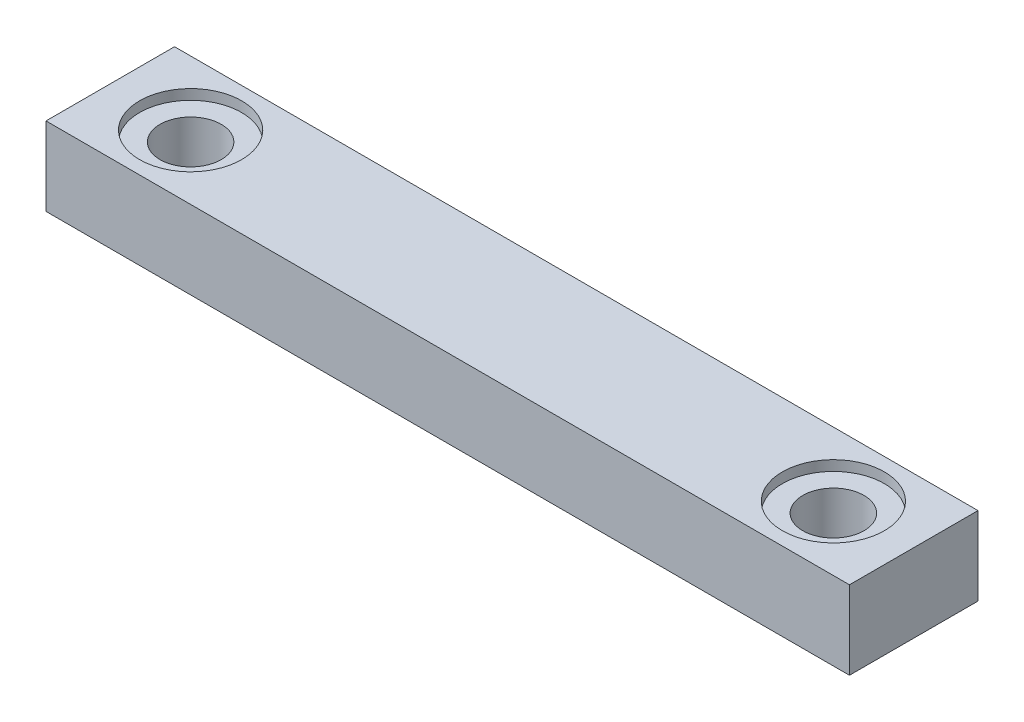
from build123d import *

# Parameters (mm, degrees)
SKETCH1_W           = 250
SKETCH1_H           = 40
SKETCH1_R           = 9.525
BOSS_EXTRUDE1_DEPTH = 24.392721671
SKETCH3_R           = 15.875
CUT_EXTRUDE1_DEPTH  = 3.175


with BuildPart() as part:
    # Sketch1 → Boss-Extrude1 (new body)
    with BuildSketch(Plane(origin=(0, 0, 0), x_dir=(1, 0, 0), z_dir=(0, 1, 0))):
        Rectangle(SKETCH1_W, SKETCH1_H)
        with Locations(Location((-100, 0, 0), (0, 0, 270))):
            Circle(SKETCH1_R, mode=Mode.SUBTRACT)
        with Locations(Location((100, 0, 0), (0, 0, 270))):
            Circle(SKETCH1_R, mode=Mode.SUBTRACT)
    extrude(amount=BOSS_EXTRUDE1_DEPTH)

    # Sketch3 → Cut-Extrude1 (cut)
    with BuildSketch(Plane(origin=(0, 24.392721671, 0), x_dir=(1, 0, 0), z_dir=(0, 1, 0))):
        with Locations(Location((-100, 0, 0), (0, 0, 270))):
            Circle(SKETCH3_R)
        with Locations(Location((100, 0, 0), (0, 0, 270))):
            Circle(SKETCH3_R)
    extrude(amount=-CUT_EXTRUDE1_DEPTH, mode=Mode.SUBTRACT)


solid = part.part
